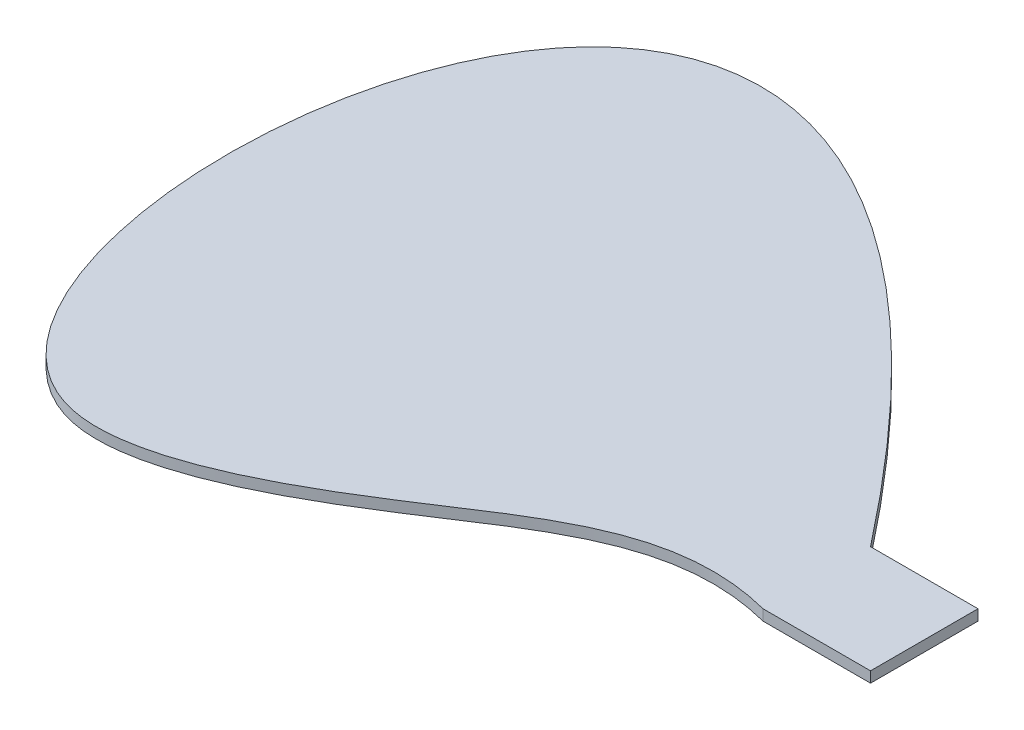
from build123d import *

# Parameters (mm, degrees)
BOSS_EXTRUDE2_DEPTH = 0.25


with BuildPart() as part:
    # Sketch1 → Boss-Extrude2 (new, symmetric)
    with BuildSketch(Plane(origin=(0, 0, 0), x_dir=(1, 0, 0), z_dir=(0, 1, 0))):
        with BuildLine():
            Line((-2.5, 2.5), (2.5, 2.5))
            Line((2.5, 2.5), (2.5, -2.5))
            Line((2.5, -2.5), (-2.5, -2.5))
            add(Edge.make_bspline(
                [(-2.5, -2.5), (-7.954517828, -1.104215092), (-14.088083086, -6.501740899), (-40.631286552, -19.870816294), (-34.680003686, 43.65787791), (-2.5, 2.5)],
                knots=[0, 0, 0, 0, 0.200882218, 0.359947113, 1, 1, 1, 1], degree=3))
        make_face()
    extrude(amount=BOSS_EXTRUDE2_DEPTH, both=True)


solid = part.part
